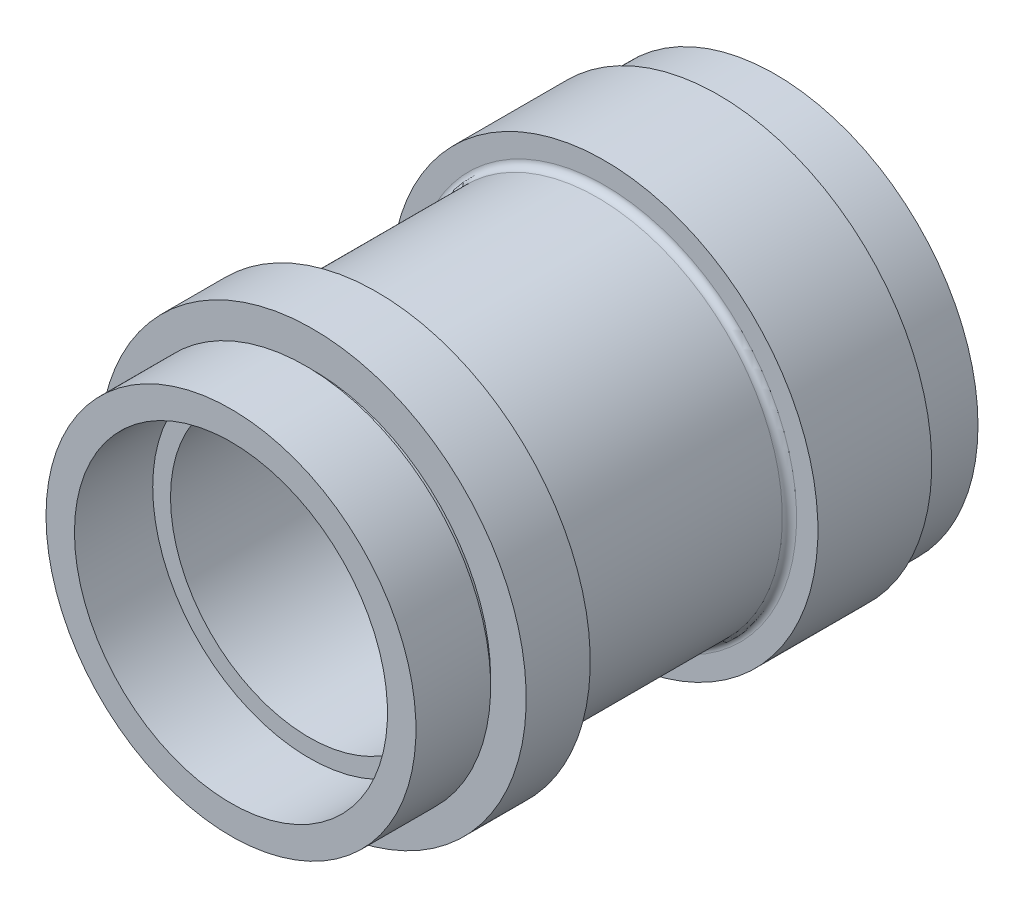
from build123d import *

# Parameters (mm, degrees)
ESQUISSE1_R                       = 14.25
BOSS_EXTRU_1_DEPTH                = 4
ESQUISSE2_R                       = 15
BOSS_EXTRU_2_DEPTH                = 28.5
ESQUISSE3_R                       = 12.5
BOSS_EXTRU_3_DEPTH                = 0.5
ESQUISSE4_R                       = 13
BOSS_EXTRU_4_DEPTH                = 5.25
DIAM_TRE_DU_PER_AGE_2_0_2_1_D     = 2
DIAM_TRE_DU_PER_AGE_2_0_2_1_DEPTH = 9
DIAM_TRE_DU_PER_AGE_2_0_2_1_TIP   = 0.600860619


with BuildPart() as part:
    # Esquisse1 → Boss.-Extru.1 (new body)
    with BuildSketch(Plane.XY):
        Circle(ESQUISSE1_R)
    extrude(amount=BOSS_EXTRU_1_DEPTH)

    # Esquisse2 → Boss.-Extru.2 (add)
    with BuildSketch(Plane.XY.offset(4)):
        with Locations(Location((0, 0, 0), (0, 0, 180))):
            Circle(ESQUISSE2_R)
    extrude(amount=BOSS_EXTRU_2_DEPTH)

    # Esquisse3 → Boss.-Extru.3 (add)
    with BuildSketch(Plane.XY.offset(32.5)):
        Circle(ESQUISSE3_R)
    extrude(amount=BOSS_EXTRU_3_DEPTH)

    # Esquisse4 → Boss.-Extru.4 (add)
    with BuildSketch(Plane.XY.offset(33)):
        with Locations(Location((0, 0, 0), (0, 0, 180))):
            Circle(ESQUISSE4_R)
    extrude(amount=BOSS_EXTRU_4_DEPTH)

    # Esquisse5 → Enlèvement de matière-Révolution1 (revolve, cut)
    with BuildSketch(Plane(origin=(0, 0, 0), x_dir=(0, 0, -1), z_dir=(1, 0, 0)), mode=Mode.PRIVATE) as enl_vement_de_mati_re_r_volution1_sk:
        Polygon((0, 0), (-38.25, 0), (-38.25, 11), (-32.75, 11), (-32.75, 9.75), (0, 9.75), align=None)
        with BuildLine():
            Line((-28, 15), (-12, 15))
            Line((-12, 15), (-12, 13.5))
            ThreePointArc((-12, 13.5), (-12.146446609, 13.146446609), (-12.5, 13))
            Line((-12.5, 13), (-27.5, 13))
            ThreePointArc((-27.5, 13), (-27.853553391, 13.146446609), (-28, 13.5))
            Line((-28, 13.5), (-28, 15))
        make_face()
    revolve(enl_vement_de_mati_re_r_volution1_sk.sketch.rotate(Axis((0, 0, 0), (0, 0, 1)), 90), axis=Axis((0, 0, 0), (0, 0, 1)), mode=Mode.SUBTRACT)

    # Diamètre du perçage Ø2.0 (2)1
    with Locations(Plane(origin=(0, 0, 0), x_dir=(-1, 0, 0), z_dir=(0, 0, -1))):
        with Locations((0, 12.75)):
            Hole(DIAM_TRE_DU_PER_AGE_2_0_2_1_D / 2, depth=DIAM_TRE_DU_PER_AGE_2_0_2_1_DEPTH)
            with Locations((0, 0, -(DIAM_TRE_DU_PER_AGE_2_0_2_1_DEPTH + DIAM_TRE_DU_PER_AGE_2_0_2_1_TIP / 2))):  # 118° drill point
                Cone(0, DIAM_TRE_DU_PER_AGE_2_0_2_1_D / 2, DIAM_TRE_DU_PER_AGE_2_0_2_1_TIP, mode=Mode.SUBTRACT)


solid = part.part
